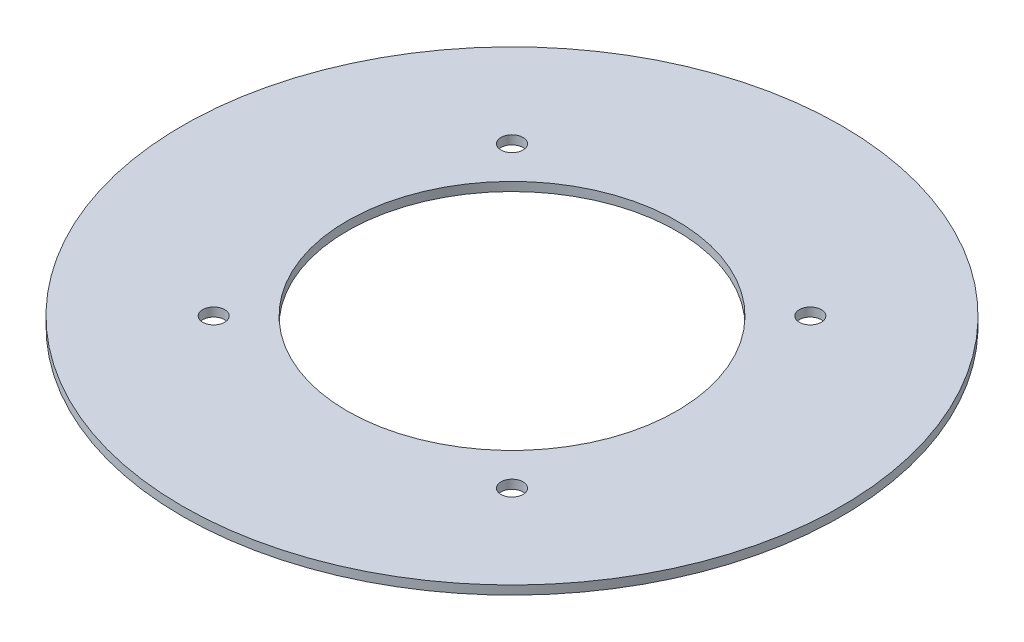
from build123d import *

# Parameters (mm, degrees)
SKETCH1_R           = 75
SKETCH1_R_2         = 37.5
BOSS_EXTRUDE1_DEPTH = 2
SKETCH2_R           = 2.5
CUT_EXTRUDE1_DEPTH  = 10


with BuildPart() as part:
    # Sketch1 → Boss-Extrude1 (new body)
    with BuildSketch(Plane(origin=(0, 0, 0), x_dir=(1, 0, 0), z_dir=(0, 1, 0))):
        with Locations(Location((0, 0, 0), (0, 0, 270))):
            Circle(SKETCH1_R)
        with Locations(Location((0, 0, 0), (0, 0, 270))):
            Circle(SKETCH1_R_2, mode=Mode.SUBTRACT)
    extrude(amount=BOSS_EXTRUDE1_DEPTH)

    # Sketch2 → Cut-Extrude1 (cut)
    with BuildSketch(Plane(origin=(0, 2, 0), x_dir=(1, 0, 0), z_dir=(0, 1, 0))):
        with Locations(Location((-33.941125497, 33.941125497, 0), (0, 0, 270))):
            Circle(SKETCH2_R)
        with Locations(Location((33.941125497, 33.941125497, 0), (0, 0, 270))):
            Circle(SKETCH2_R)
        with Locations(Location((33.941125497, -33.941125497, 0), (0, 0, 270))):
            Circle(SKETCH2_R)
        with Locations(Location((-33.941125497, -33.941125497, 0), (0, 0, 270))):
            Circle(SKETCH2_R)
    extrude(amount=-CUT_EXTRUDE1_DEPTH, mode=Mode.SUBTRACT)


solid = part.part
